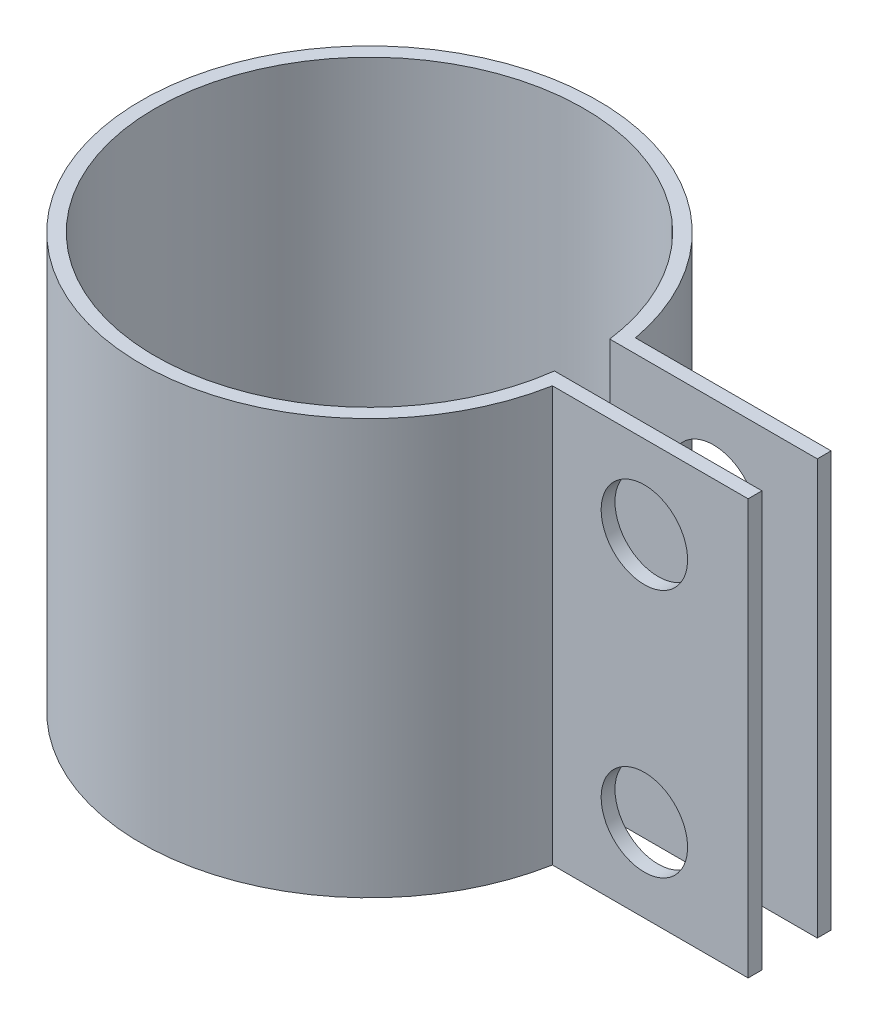
from build123d import *

# Parameters (mm, degrees)
EXTRUDE_1_DEPTH                = 6
HOLE_WIZARD_M1_6_1_D           = 1.25
HOLE_WIZARD_M1_6_1_CSINK_D     = 1.65
HOLE_WIZARD_M1_6_1_CSINK_ANGLE = 90


with BuildPart() as part:
    # 草图2 → 凸台-拉伸1 (new body)
    with BuildSketch(Plane(origin=(0, 0, 0), x_dir=(1, 0, 0), z_dir=(0, 1, 0))):
        with BuildLine():
            Line((3.07408523, 0.4), (6.07408523, 0.4))
            Line((6.07408523, 0.4), (6.07408523, 0.6))
            Line((6.07408523, 0.6), (3.244996148, 0.6))
            ThreePointArc((3.244996148, 0.6), (-3.3, 0), (3.244996148, -0.6))
            Line((3.244996148, -0.6), (6.07408523, -0.6))
            Line((6.07408523, -0.6), (6.07408523, -0.4))
            Line((6.07408523, -0.4), (3.07408523, -0.4))
            ThreePointArc((3.07408523, -0.4), (-3.1, 0), (3.07408523, 0.4))
        make_face()
    extrude(amount=EXTRUDE_1_DEPTH)

    # M1.6 螺纹孔1 (through all)
    with Locations(Plane(origin=(0, 0, -0.6), x_dir=(-1, 0, 0), z_dir=(0, 0, -1))):
        with Locations((-4.57408523, 4.8), (-4.57408523, 1.2)):
            CounterSinkHole(HOLE_WIZARD_M1_6_1_D / 2, HOLE_WIZARD_M1_6_1_CSINK_D / 2, counter_sink_angle=HOLE_WIZARD_M1_6_1_CSINK_ANGLE)


solid = part.part
